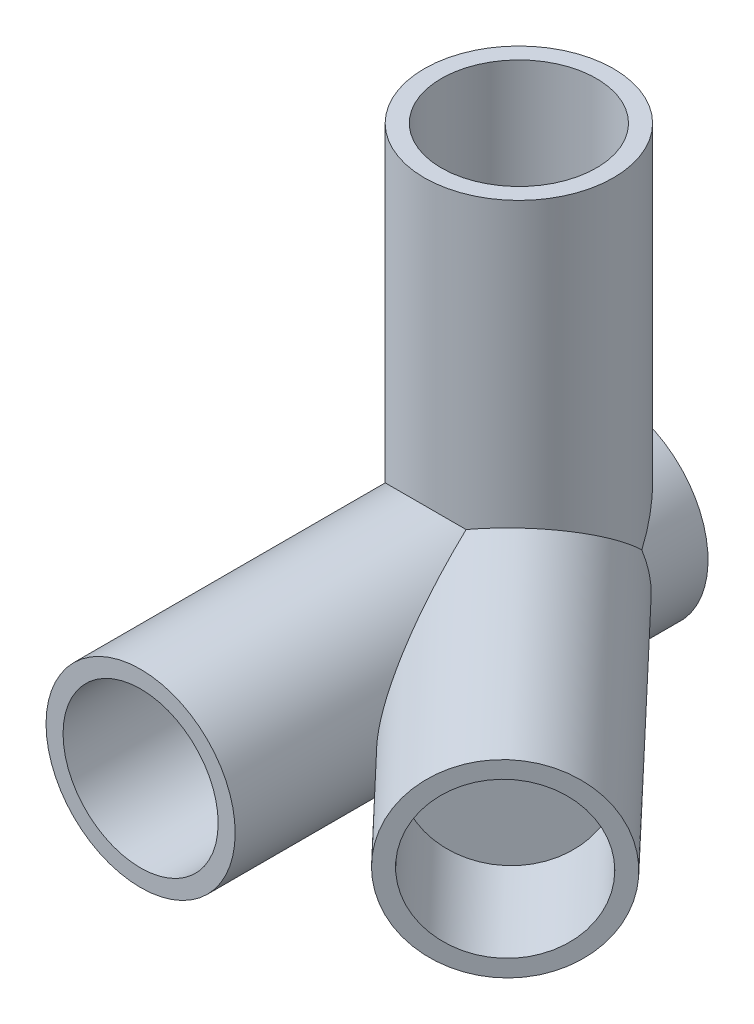
from build123d import *
from build123d.topology import SkipClean

# Parameters (mm, degrees)
SKETCH_1_R          = 5
SKETCH_1_R_2        = 4.1
EXTRUDE_1_DEPTH     = 25
SKETCH_2_R          = 5.0000000000000036
SKETCH_2_R_2        = 4.1
EXTRUDE_2_DEPTH     = 20
SKETCH_4_R          = 4.1
CUT_EXTRUDE_1_DEPTH = 14.999999999999998
SKETCH_5_R          = 4.590656492377237
EXTRUDE_3_DEPTH     = 19
SKETCH_6_R          = 5.0000000000000036
EXTRUDE_4_DEPTH     = 2
SKETCH_10_R         = 5.000000000000004
EXTRUDE_5_DEPTH     = 1


with BuildPart() as part:
    # 草图1 → 凸台-拉伸1 (new body)
    with BuildSketch(Plane.XY):
        Circle(SKETCH_1_R)
        Circle(SKETCH_1_R_2, mode=Mode.SUBTRACT)
    extrude(amount=EXTRUDE_1_DEPTH)

    # 草图2 → 凸台-拉伸2 (add)
    with SkipClean():  # the faces are left unmerged after this step: merging them gives an invalid solid
        with BuildSketch(Plane(origin=(0, 0, 0), x_dir=(1, 0, 0), z_dir=(0, 1, 0))):
            with Locations(Location((0, -5, 0), (0, 0, 90))):
                Circle(SKETCH_2_R)
            with Locations(Location((0, -5, 0), (0, 0, 90))):
                Circle(SKETCH_2_R_2, mode=Mode.SUBTRACT)
        extrude(amount=EXTRUDE_2_DEPTH)

    # 草图3 → 旋转2 (revolve)
    with SkipClean():  # the faces are left unmerged after this step: merging them gives an invalid solid
        with BuildSketch(Plane(origin=(0, 0, 0), x_dir=(1, 0, 0), z_dir=(0, 1, 0)), mode=Mode.PRIVATE) as revolve_2_sk:
            Polygon((0, -5), (13.774685729015161, -19.500276999659906), (17.39975497893014, -16.056605567406113), (3.6250692499149775, -1.5563285677462084), align=None)
        revolve(revolve_2_sk.sketch.rotate(Axis((0, 0, 5), (0.6887342864507581, 0, 0.7250138499829953)), 180), axis=Axis((0, 0, 5), (0.6887342864507581, 0, 0.7250138499829953)))

    # 草图4 → 切除-拉伸1 (cut)
    with SkipClean():  # the faces are left unmerged after this step: merging them gives an invalid solid
        with BuildSketch(Plane(origin=(16.271395212189944, 0, 17.12850241299574), x_dir=(0.7250138499829951, 0, -0.6887342864507582), z_dir=(0.6887342864507582, 0, 0.7250138499829951))):
            with Locations((-3.4436714322537907, 0)):
                Circle(SKETCH_4_R)
        extrude(amount=-CUT_EXTRUDE_1_DEPTH, mode=Mode.SUBTRACT)

    # 草图5 → 凸台-拉伸3 (add)
    with SkipClean():  # the faces are left unmerged after this step: merging them gives an invalid solid
        with BuildSketch(Plane(origin=(0, 0, 0), x_dir=(-1, 0, 0), z_dir=(0, 0, -1))):
            Circle(SKETCH_5_R)
        extrude(amount=-EXTRUDE_3_DEPTH)

    # 草图6 → 凸台-拉伸4 (add)
    with SkipClean():  # the faces are left unmerged after this step: merging them gives an invalid solid
        with BuildSketch(Plane(origin=(0, 6, 0), x_dir=(1, 0, 0), z_dir=(0, 1, 0))):
            with Locations(Location((0, -5, 0), (0, 0, 90))):
                Circle(SKETCH_6_R)
        extrude(amount=EXTRUDE_4_DEPTH)

    # 草图10 → 凸台-拉伸5 (add)
    with SkipClean():  # the faces are left unmerged after this step: merging them gives an invalid solid
        with BuildSketch(Plane(origin=(11.450255207034635, 0, 12.05340546311477), x_dir=(0.7250138499829952, 0, -0.6887342864507582), z_dir=(0.6887342864507582, 0, 0.7250138499829952))):
            with Locations(Location((-3.4436714322537925, 0, 0), (0, 0, 180))):
                Circle(SKETCH_10_R)
        extrude(amount=EXTRUDE_5_DEPTH)


solid = part.part
